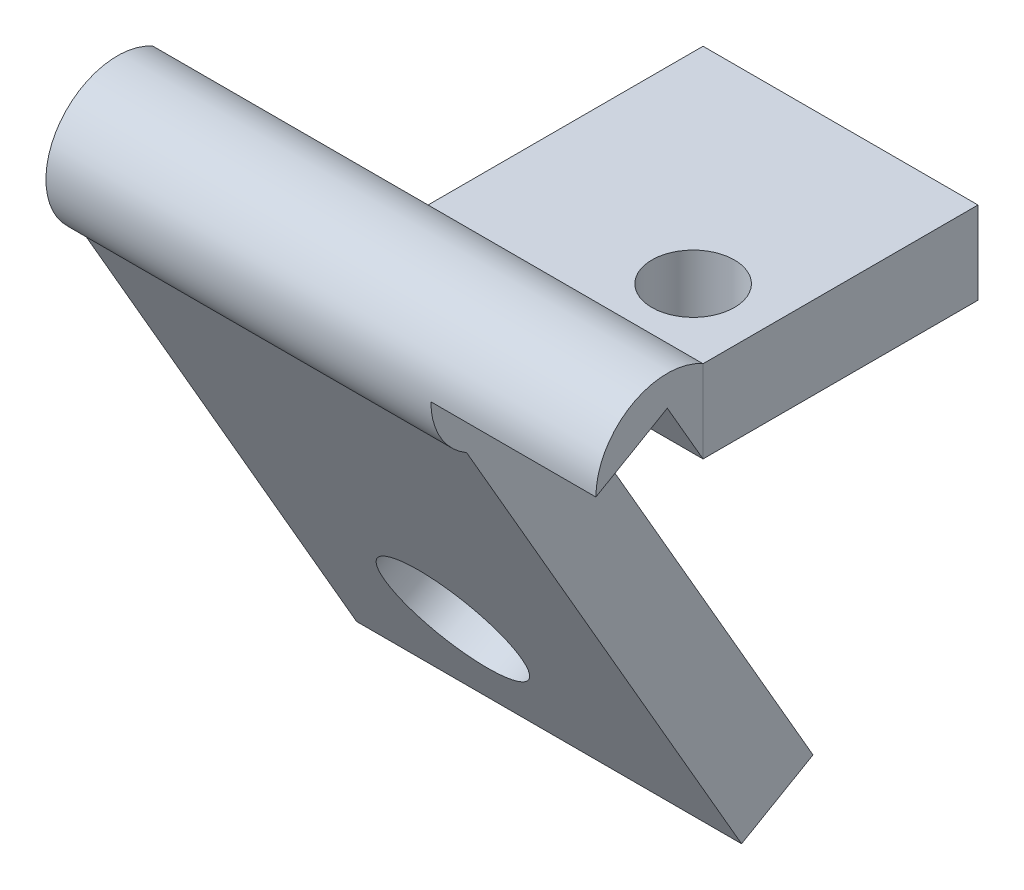
from build123d import *

# Parameters (mm, degrees)
SKETCH_1_W          = 10
SKETCH_1_H          = 10
SKETCH_1_R          = 1.5
EXTRUDE_1_DEPTH     = 3
EXTRUDE_3_DEPTH     = 20
SKETCH_4_R          = 2.5
CUT_EXTRUDE_1_DEPTH = 10
SKETCH_5_W          = 6
SKETCH_5_H          = 22.598076211
CUT_EXTRUDE_2_DEPTH = 10


with BuildPart() as part:
    # 草圖1 → 填料-伸長1 (new body)
    with BuildSketch(Plane(origin=(0, 0, 0), x_dir=(1, 0, 0), z_dir=(0, 1, 0))):
        with Locations((0.64, -2.23)):
            Rectangle(SKETCH_1_W, SKETCH_1_H)
        with Locations(Location((2.94, -4.89, 0), (0, 0, 270))):
            Circle(SKETCH_1_R, mode=Mode.SUBTRACT)
    extrude(amount=EXTRUDE_1_DEPTH)


with BuildPart() as body_2:
    # 草圖3 → 填料-伸長3 (new body)
    with BuildSketch(Plane(origin=(5.64, 0, 0), x_dir=(0, 0, -1), z_dir=(1, 0, 0))):
        with BuildLine():
            ThreePointArc((-7.23, 3), (-10.779038106, 2.049038106), (-9.828076211, -1.5))
            Line((-9.828076211, -1.5), (-7.23, 0))
            Line((-7.23, 0), (-7.23, 3))
        make_face()
        Polygon((-9.828076211, -1.5), (-7.23, 0), (2.77, -17.320508076), (0.171923789, -18.820508076), align=None)
    extrude(amount=-EXTRUDE_3_DEPTH)

    # 草圖4 → 除料-伸長1 (cut)
    with BuildSketch(Plane(origin=(0, -3.130681835, 5.4225), x_dir=(-1, 0, 0), z_dir=(0, 0.4999999999999977, -0.8660254037844399))):
        with Locations(Location((8.36, -11.385, 0), (0, 0, 90))):
            Circle(SKETCH_4_R)
    extrude(amount=-CUT_EXTRUDE_1_DEPTH, mode=Mode.SUBTRACT)

    # 草圖5 → 除料-伸長2 (cut)
    with BuildSketch(Plane(origin=(0, -3.130681835, 5.4225), x_dir=(-1, 0, 0), z_dir=(0, 0.4999999999999977, -0.8660254037844399))):
        with Locations((-2.64, -5.085961895)):
            Rectangle(SKETCH_5_W, SKETCH_5_H)
    extrude(amount=-CUT_EXTRUDE_2_DEPTH, mode=Mode.SUBTRACT)


solid = Compound([part.part, body_2.part])
